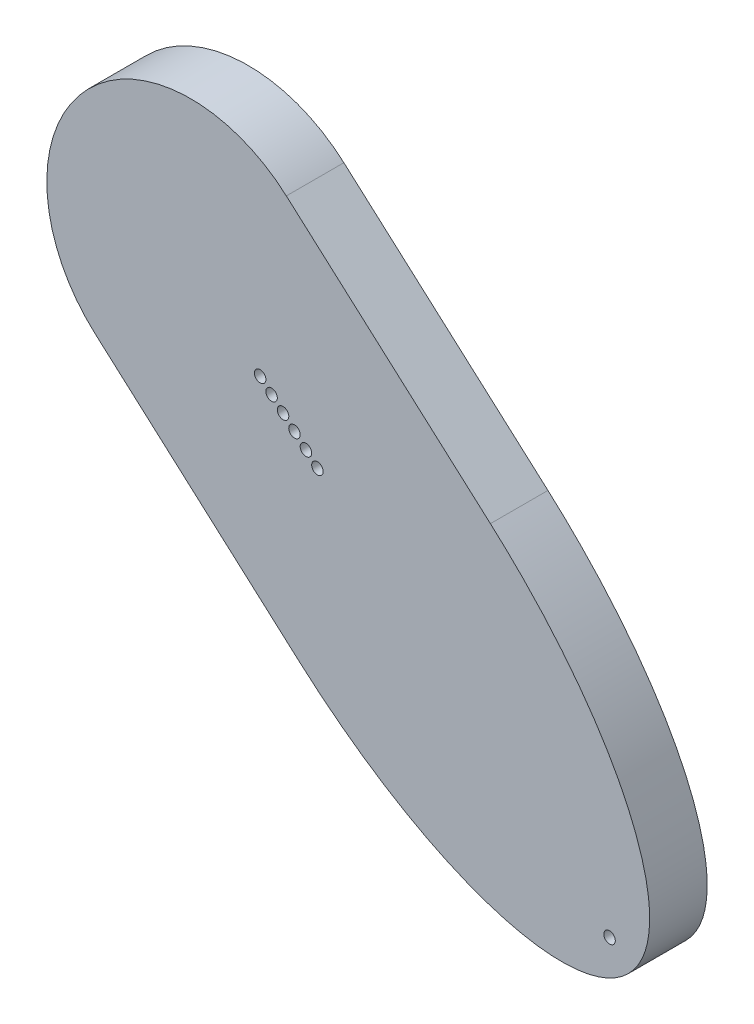
from build123d import *

# Parameters (mm, degrees)
BOSS_EXTRU_1_START      = -10
ESQUISSE1_R             = 1
BOSS_EXTRU_1_DEPTH      = 10
BOSS_EXTRU_4_DEPTH      = 4
ESQUISSE3_R             = 1
ENL_V_MAT_EXTRU_1_DEPTH = 109.372369122


with BuildPart() as part:
    # Esquisse1 → Boss.-Extru.1 (new body)
    with BuildSketch(Plane.XY.offset(BOSS_EXTRU_1_START)):
        with BuildLine():
            add(Edge.make_bspline(
                [(18.84048499, -50.262173902), (59.909901441, -86.844998182), (76.538457933, -68.177081613)],
                knots=[4.71238898, 4.71238898, 4.71238898, 6.283185307, 6.283185307, 6.283185307], degree=2, weights=[1, 0.707106781, 1]))
            add(Edge.make_bspline(
                [(76.538457933, -68.177081613), (93.167014424, -49.509165044), (52.097597972, -12.926340764)],
                knots=[0, 0, 0, 1.570796327, 1.570796327, 1.570796327], degree=2, weights=[1, 0.707106781, 1]))
            Line((52.097597972, -12.926340764), (16.628556491, 18.667916569))
            ThreePointArc((16.628556491, 18.667916569), (-18.667916569, 16.628556491), (-16.628556491, -18.667916569))
            Line((-16.628556491, -18.667916569), (18.84048499, -50.262173902))
        make_face()
        with Locations((72.804874619, -64.851370315)):
            Circle(ESQUISSE1_R, mode=Mode.SUBTRACT)
    extrude(amount=-BOSS_EXTRU_1_DEPTH)

    # Esquisse2 → Boss.-Extru.4 (add)
    with BuildSketch(Plane(origin=(0, 0, -20), x_dir=(-1, 0, 0), z_dir=(0, 0, -1))):
        with BuildLine():
            Line((-23.527848394, -14.931187158), (-30.51184212, -7.090662199))
            ThreePointArc((-30.51184212, -7.090662199), (-35.509733497, -17.426184936), (-31.735458167, -28.268546035))
            Line((-31.735458167, -28.268546035), (-23.894933208, -21.284552309))
            ThreePointArc((-23.894933208, -21.284552309), (-25.027215807, -18.031843979), (-23.527848394, -14.931187158))
        make_face()
        with BuildLine():
            ThreePointArc((-31.735458167, -28.268546035), (-21.39993543, -33.266437412), (-10.557574331, -29.492162082))
            Line((-10.557574331, -29.492162082), (-17.541568057, -21.651637123))
            ThreePointArc((-17.541568057, -21.651637123), (-20.794276387, -22.783919722), (-23.894933208, -21.284552309))
            Line((-23.894933208, -21.284552309), (-31.735458167, -28.268546035))
        make_face()
        with BuildLine():
            Line((-23.527848394, -14.931187158), (-30.51184212, -7.090662199))
            ThreePointArc((-30.51184212, -7.090662199), (-35.509733497, -17.426184936), (-31.735458167, -28.268546035))
            Line((-31.735458167, -28.268546035), (-23.894933208, -21.284552309))
            ThreePointArc((-23.894933208, -21.284552309), (-25.027215807, -18.031843979), (-23.527848394, -14.931187158))
        make_face()
        with BuildLine():
            ThreePointArc((-31.735458167, -28.268546035), (-21.39993543, -33.266437412), (-10.557574331, -29.492162082))
            Line((-10.557574331, -29.492162082), (-17.541568057, -21.651637123))
            ThreePointArc((-17.541568057, -21.651637123), (-20.794276387, -22.783919722), (-23.894933208, -21.284552309))
            Line((-23.894933208, -21.284552309), (-31.735458167, -28.268546035))
        make_face()
        with BuildLine():
            ThreePointArc((-14.254741883, -4.669296932), (-22.744462605, -3.455072107), (-30.51184212, -7.090662199))
            Line((-30.51184212, -7.090662199), (-23.527848394, -14.931187158))
            Line((-23.527848394, -14.931187158), (-14.166195215, -4.931421004))
            ThreePointArc((-14.166195215, -4.931421004), (-14.211072924, -4.800563129), (-14.254741883, -4.669296932))
        make_face()
        with BuildLine():
            Line((-17.541568057, -21.651637123), (-10.557574331, -29.492162082))
            ThreePointArc((-10.557574331, -29.492162082), (-6.847907862, -24.429123097), (-5.534708226, -18.29141214))
            ThreePointArc((-5.534708226, -18.29141214), (-5.722194458, -15.927213359), (-6.279966343, -13.622115208))
            ThreePointArc((-6.279966343, -13.622115208), (-6.405329622, -13.563618707), (-6.530148083, -13.503968528))
            Line((-6.530148083, -13.503968528), (-17.541568057, -21.651637123))
        make_face()
        with BuildLine():
            ThreePointArc((-5.522244788, 4.301722039), (-5.110106455, 4.784016306), (-4.655995817, 5.227016639))
            Line((-4.655995817, 5.227016639), (-9.977133895, 11.200749941))
            ThreePointArc((-9.977133895, 11.200749941), (-14.483112506, 3.903774088), (-14.254741883, -4.669296932))
            ThreePointArc((-14.254741883, -4.669296932), (-14.138662596, -4.723413014), (-14.023049593, -4.778518229))
            Line((-14.023049593, -4.778518229), (-5.522244788, 4.301722039))
        make_face()
        with BuildLine():
            Line((-9.977133895, 11.200749941), (-4.655995817, 5.227016639))
            ThreePointArc((-4.655995817, 5.227016639), (2.864265113, 6.387173503), (7, 0))
            ThreePointArc((7, 0), (6.387173503, -2.864265113), (4.655995817, -5.227016639))
            Line((4.655995817, -5.227016639), (9.977133895, -11.200749941))
            ThreePointArc((9.977133895, -11.200749941), (13.686800364, -6.137710957), (15, 0))
            ThreePointArc((15, 0), (6.137710957, 13.686800364), (-9.977133895, 11.200749941))
        make_face()
        with BuildLine():
            Line((9.977133895, -11.200749941), (4.655995817, -5.227016639))
            ThreePointArc((4.655995817, -5.227016639), (4.163642753, -5.627084416), (3.637091246, -5.980933645))
            Line((3.637091246, -5.980933645), (-6.361776479, -13.379385501))
            ThreePointArc((-6.361776479, -13.379385501), (-6.320353283, -13.500575724), (-6.279966343, -13.622115208))
            ThreePointArc((-6.279966343, -13.622115208), (2.209754379, -14.836340033), (9.977133895, -11.200749941))
        make_face()
        with BuildLine():
            Line((-10.557574331, -29.492162082), (9.977133895, -11.200749941))
            ThreePointArc((9.977133895, -11.200749941), (2.209754379, -14.836340033), (-6.279966343, -13.622115208))
            ThreePointArc((-6.279966343, -13.622115208), (-5.722194458, -15.927213359), (-5.534708226, -18.29141214))
            ThreePointArc((-5.534708226, -18.29141214), (-6.847907862, -24.429123097), (-10.557574331, -29.492162082))
        make_face()
        with BuildLine():
            ThreePointArc((-14.254741883, -4.669296932), (-14.483112506, 3.903774088), (-9.977133895, 11.200749941))
            Line((-9.977133895, 11.200749941), (-30.51184212, -7.090662199))
            ThreePointArc((-30.51184212, -7.090662199), (-22.744462605, -3.455072107), (-14.254741883, -4.669296932))
        make_face()
    extrude(amount=BOSS_EXTRU_4_DEPTH)

    # Esquisse3 → Enlèv. mat.-Extru.1 (cut, through all)
    with BuildSketch(Plane(origin=(0, 0, -20), x_dir=(-1, 0, 0), z_dir=(0, 0, -1))):
        with Locations((-20.036872227, -17.847961796)):
            Circle(ESQUISSE3_R)
        with Locations((-22.028141551, -19.621696659)):
            Circle(ESQUISSE3_R)
        with Locations((-18.045602902, -16.074226932)):
            Circle(ESQUISSE3_R)
        with Locations((-16.054333578, -14.300492068)):
            Circle(ESQUISSE3_R)
        with Locations((-14.063064253, -12.526757204)):
            Circle(ESQUISSE3_R)
        with Locations((-12.071794928, -10.753022341)):
            Circle(ESQUISSE3_R)
    extrude(amount=-ENL_V_MAT_EXTRU_1_DEPTH, mode=Mode.SUBTRACT)


solid = part.part
